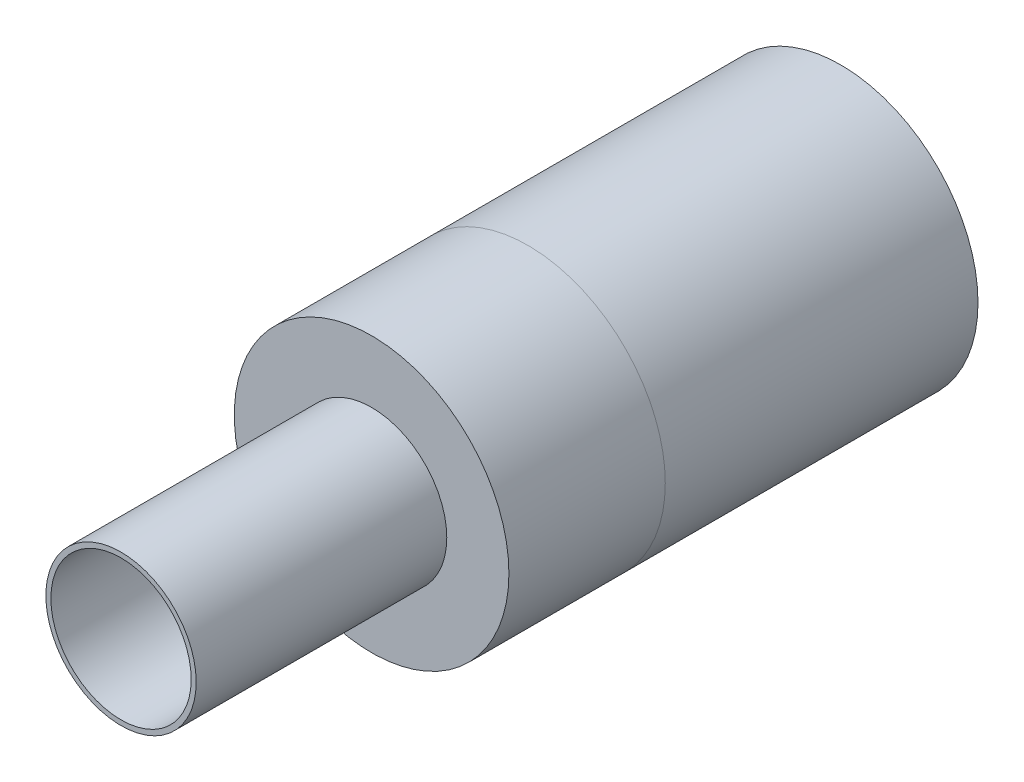
from build123d import *

# Parameters (mm, degrees)
SKETCH1_R           = 17.399
BOSS_EXTRUDE1_DEPTH = 59.436
SKETCH2_R           = 9.525
BOSS_EXTRUDE2_DEPTH = 31.75
SKETCH5_R           = 8.89
CUT_EXTRUDE1_DEPTH  = 91.186


with BuildPart() as part:
    # Sketch1 → Boss-Extrude1 (new body)
    with BuildSketch(Plane.XY):
        Circle(SKETCH1_R)
    extrude(amount=BOSS_EXTRUDE1_DEPTH)

    # Sketch2 → Boss-Extrude2 (add)
    with BuildSketch(Plane.XY.offset(59.436)):
        Circle(SKETCH2_R)
    extrude(amount=BOSS_EXTRUDE2_DEPTH)

    # Sketch5 → Cut-Extrude1 (cut)
    with BuildSketch(Plane(origin=(0, 0, 0), x_dir=(-1, 0, 0), z_dir=(0, 0, -1))):
        Circle(SKETCH5_R)
    extrude(amount=-CUT_EXTRUDE1_DEPTH, mode=Mode.SUBTRACT)


solid = part.part
